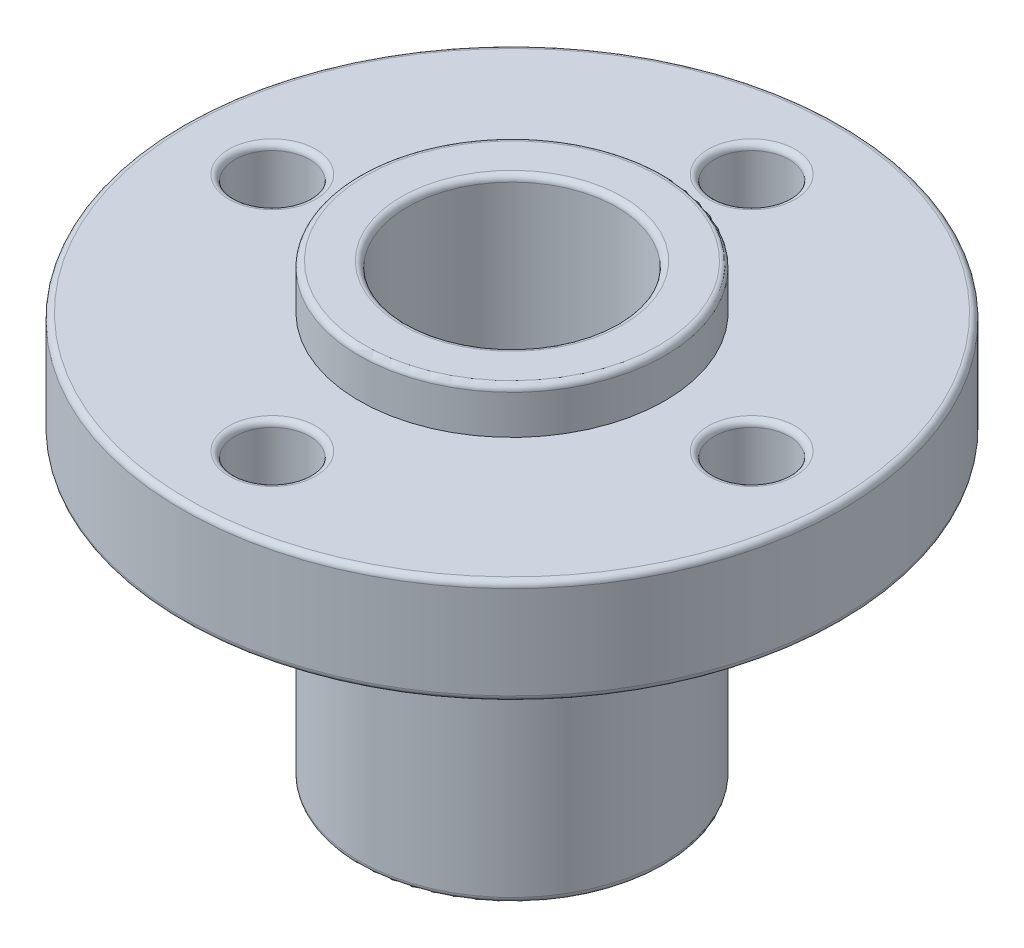
from build123d import *

# Parameters (mm, degrees)
CUT_EXTRUDE1_REACH = 22.597
SKETCH2_R          = 1.25
FILLET1_R          = 0.2


with BuildPart() as part:
    # Sketch1 → Revolve1 (revolve)
    with BuildSketch(Plane.XY):
        with BuildLine():
            Line((3.7, 3.25), (4.9, 3.25))
            ThreePointArc((4.9, 3.25), (5.041421356, 3.191421356), (5.1, 3.05))
            Line((5.1, 3.05), (5.1, 1.75))
            Line((5.1, 1.75), (10.8, 1.75))
            ThreePointArc((10.8, 1.75), (10.941421356, 1.691421356), (11, 1.55))
            Line((11, 1.55), (11, -1.55))
            ThreePointArc((11, -1.55), (10.941421356, -1.691421356), (10.8, -1.75))
            Line((10.8, -1.75), (5.1, -1.75))
            Line((5.1, -1.75), (5.1, -11.55))
            ThreePointArc((5.1, -11.55), (5.041421356, -11.691421356), (4.9, -11.75))
            Line((4.9, -11.75), (3.7, -11.75))
            ThreePointArc((3.7, -11.75), (3.558578644, -11.691421356), (3.5, -11.55))
            Line((3.5, -11.55), (3.5, 3.05))
            ThreePointArc((3.5, 3.05), (3.558578644, 3.191421356), (3.7, 3.25))
        make_face()
    revolve(axis=Axis((0, -213.929131969, 0), (0, 1, 0)))

    # Sketch2 → Cut-Extrude1 (cut, up to next)
    with BuildSketch(Plane(origin=(0, 1.75, 0), x_dir=(1, 0, 0), z_dir=(0, 1, 0)), mode=Mode.PRIVATE) as cut_extrude1_sk1:
        with Locations(Location((8, 0, 0), (0, 0, 180))):
            Circle(SKETCH2_R)
    cut_extrude1_tool1 = extrude(cut_extrude1_sk1.sketch, amount=-CUT_EXTRUDE1_REACH, mode=Mode.PRIVATE) & part.part
    # Sketch2 → Cut-Extrude1 (cut, up to next)
    with BuildSketch(Plane(origin=(0, 1.75, 0), x_dir=(1, 0, 0), z_dir=(0, 1, 0)), mode=Mode.PRIVATE) as cut_extrude1_sk2:
        with Locations(Location((0, -8, 0), (0, 0, 180))):
            Circle(SKETCH2_R)
    cut_extrude1_tool2 = extrude(cut_extrude1_sk2.sketch, amount=-CUT_EXTRUDE1_REACH, mode=Mode.PRIVATE) & part.part
    # Sketch2 → Cut-Extrude1 (cut, up to next)
    with BuildSketch(Plane(origin=(0, 1.75, 0), x_dir=(1, 0, 0), z_dir=(0, 1, 0)), mode=Mode.PRIVATE) as cut_extrude1_sk3:
        with Locations(Location((-8, 0, 0), (0, 0, 180))):
            Circle(SKETCH2_R)
    cut_extrude1_tool3 = extrude(cut_extrude1_sk3.sketch, amount=-CUT_EXTRUDE1_REACH, mode=Mode.PRIVATE) & part.part
    # Sketch2 → Cut-Extrude1 (cut, up to next)
    with BuildSketch(Plane(origin=(0, 1.75, 0), x_dir=(1, 0, 0), z_dir=(0, 1, 0)), mode=Mode.PRIVATE) as cut_extrude1_sk4:
        with Locations(Location((0, 8, 0), (0, 0, 180))):
            Circle(SKETCH2_R)
    cut_extrude1_tool4 = extrude(cut_extrude1_sk4.sketch, amount=-CUT_EXTRUDE1_REACH, mode=Mode.PRIVATE) & part.part
    add(cut_extrude1_tool1.solids().sort_by_distance((8, 1.75, 0))[0], mode=Mode.SUBTRACT)
    add(cut_extrude1_tool2.solids().sort_by_distance((0, 1.75, 8))[0], mode=Mode.SUBTRACT)
    add(cut_extrude1_tool3.solids().sort_by_distance((-8, 1.75, 0))[0], mode=Mode.SUBTRACT)
    add(cut_extrude1_tool4.solids().sort_by_distance((0, 1.75, -8))[0], mode=Mode.SUBTRACT)

    # Fillet1
    fillet1_edges = [part.edges().sort_by_distance(p)[0] for p in [
        (9.25, -1.75, 0),
        (9.25, 1.75, 0),
        (1.25, -1.75, 8),
        (1.25, 1.75, 8),
        (-6.75, -1.75, 0),
        (-6.75, 1.75, 0),
        (1.25, -1.75, -8),
        (1.25, 1.75, -8),
    ]]
    fillet(fillet1_edges, radius=FILLET1_R)


solid = part.part
